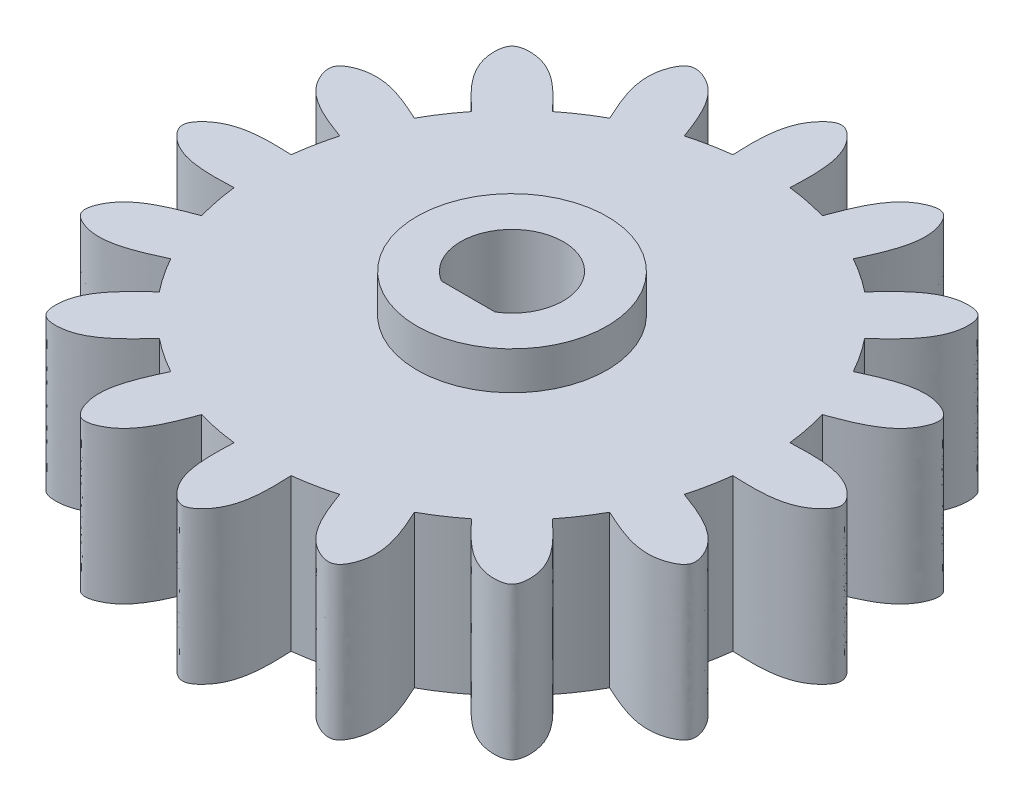
from build123d import *

# Parameters (mm, degrees)
SKETCH1_R           = 13.2
BOSS_EXTRUDE1_DEPTH = 10
SKETCH2_R           = 5
BOSS_EXTRUDE2_DEPTH = 2
BOSS_EXTRUDE5_DEPTH = 10
CIRPATTERN1_COUNT   = 16
CUT_EXTRUDE1_DEPTH  = 28.286884568
SKETCH6_R           = 36.478702283
CUT_EXTRUDE2_DEPTH  = 2


with BuildPart() as part:
    # Sketch1 → Boss-Extrude1 (new body)
    with BuildSketch(Plane(origin=(0, 0, 0), x_dir=(1, 0, 0), z_dir=(0, 1, 0))):
        with Locations(Location((0, 0, 0), (0, 0, 270))):
            Circle(SKETCH1_R)
    extrude(amount=BOSS_EXTRUDE1_DEPTH)

    # Sketch2 → Boss-Extrude2 (add)
    with BuildSketch(Plane(origin=(0, 10, 0), x_dir=(1, 0, 0), z_dir=(0, 1, 0))):
        with Locations(Location((0, 0, 0), (0, 0, 270))):
            Circle(SKETCH2_R)
    extrude(amount=BOSS_EXTRUDE2_DEPTH)

    # Sketch4 → Boss-Extrude5 (add)
    with BuildSketch(Plane.XZ):
        with BuildLine():
            Line((-1.5, -13.114495797), (1.5, -13.114495797))
            add(Edge.make_bspline(
                [(1.5, -13.114495797), (1.52233311, -13.679701044), (1.574363817, -14.996491562), (1.199302648, -16.609971754), (0, -17.517760626), (-1.199302648, -16.609971754), (-1.574363817, -14.996491562), (-1.52233311, -13.679701044), (-1.5, -13.114495797)],
                knots=[0, 0, 0, 0, 0.178316257, 0.415433434, 0.5, 0.584566566, 0.821683743, 1, 1, 1, 1], degree=3))
        make_face()
    boss_extrude5 = extrude(amount=-BOSS_EXTRUDE5_DEPTH)

    # CirPattern1: Boss-Extrude5 ×16 about axis
    cirpattern1_axis = Axis((0, 0, 0), (0, -1, 0))
    for i in range(1, CIRPATTERN1_COUNT):
        add(boss_extrude5.rotate(cirpattern1_axis, i * 360 / CIRPATTERN1_COUNT))

    # Sketch5 → Cut-Extrude1 (cut, through all)
    with BuildSketch(Plane(origin=(0, 12, 0), x_dir=(1, 0, 0), z_dir=(0, 1, 0))):
        with BuildLine():
            Line((1.414213562, -2.3), (-1.414213562, -2.3))
            ThreePointArc((-1.414213562, -2.3), (0, 2.7), (1.414213562, -2.3))
        make_face()
    extrude(amount=-CUT_EXTRUDE1_DEPTH, mode=Mode.SUBTRACT)

    # Sketch6 → Cut-Extrude2 (cut)
    with BuildSketch(Plane.XZ):
        Circle(SKETCH6_R)
    extrude(amount=-CUT_EXTRUDE2_DEPTH, mode=Mode.SUBTRACT)


solid = part.part
